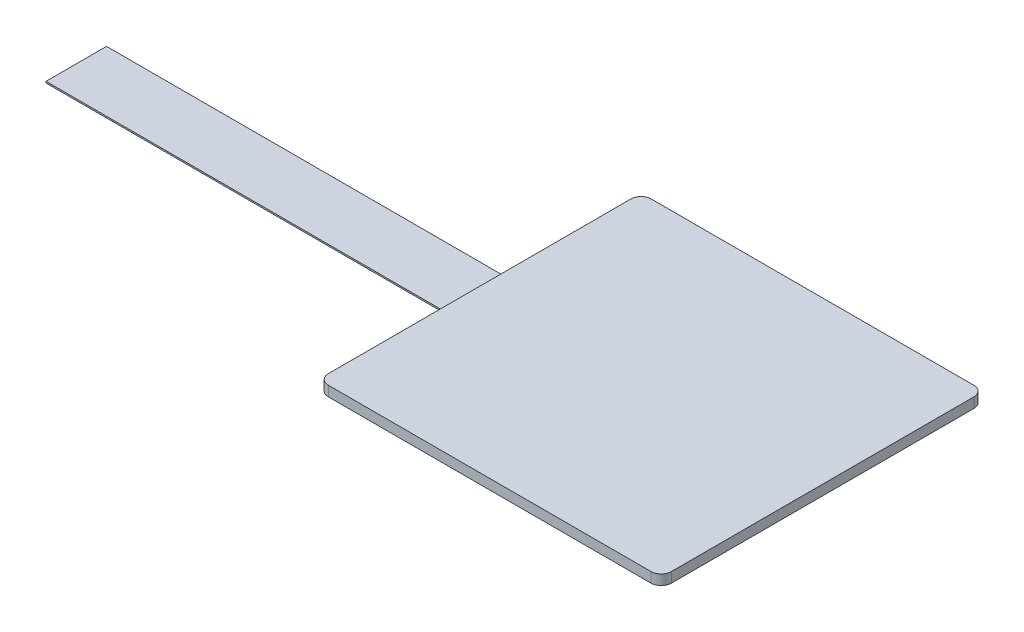
from build123d import *

# Parameters (mm, degrees)
SKETCH_1_W           = 34
SKETCH_1_H           = 32
EXTRUDE_1_DEPTH      = 1
EXTRUDE_2_DEPTH      = 0.1
EXTRUDE_2_DEPTH_BACK = 0.05
SKETCH_2_W           = 40
SKETCH_2_H           = 6
FILLET_1_R           = 1


with BuildPart() as part:
    # 草圖1 → 填料-伸長1 (new body)
    with BuildSketch(Plane(origin=(0, 0, 0), x_dir=(1, 0, 0), z_dir=(0, 1, 0))):
        Rectangle(SKETCH_1_W, SKETCH_1_H)
    extrude(amount=EXTRUDE_1_DEPTH)

    # 草圖2 → 填料-伸長2 (add, two sides: drawn at the far end of the back side and taken through both)
    with BuildSketch(Plane(origin=(0, 0, 0), x_dir=(1, 0, 0), z_dir=(0, 1, 0)).offset(-EXTRUDE_2_DEPTH_BACK)):
        with Locations((-37, 0)):
            Rectangle(SKETCH_2_W, SKETCH_2_H)
    extrude(amount=EXTRUDE_2_DEPTH + EXTRUDE_2_DEPTH_BACK)

    # 圓角1
    fillet_1_edges = [part.edges().sort_by_distance(p)[0] for p in [
        (-17, 0.5, -16),
        (17, 0.5, -16),
        (17, 0.5, 16),
        (-17, 0.5, 16),
    ]]
    fillet(fillet_1_edges, radius=FILLET_1_R)


solid = part.part
